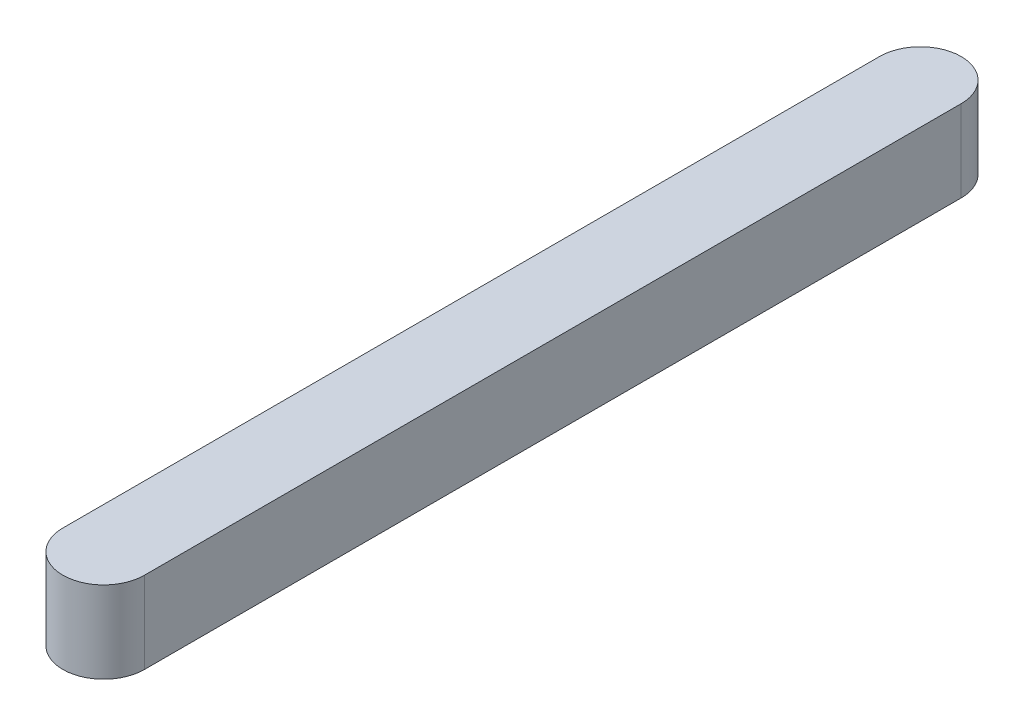
from build123d import *

# Parameters (mm, degrees)
SKETCH1_W           = 34.925
SKETCH1_H           = 3.175
BOSS_EXTRUDE1_DEPTH = 3.175
FILLET1_RADIUS      = 1.5875
FILLET1_LENGTH      = 3.175
FILLET2_RADIUS      = 1.5875
FILLET2_LENGTH      = 3.175


with BuildPart() as part:
    # Sketch1 → Boss-Extrude1 (new body)
    with BuildSketch(Plane(origin=(0, 0, 0), x_dir=(0, 0, -1), z_dir=(1, 0, 0))):
        with Locations((17.4625, 1.5875)):
            Rectangle(SKETCH1_W, SKETCH1_H)
    extrude(amount=BOSS_EXTRUDE1_DEPTH)

    # Fillet1: full round fillet: the end face becomes a half cylinder, R = half its width
    fillet1_face = Plane((1.5875, 1.5875, 0), x_dir=(0, 1, 0), z_dir=(0, 0, 1))  # on the end face: x along it, z out of the body
    fillet1_slab = fillet1_face.offset(-FILLET1_RADIUS / 2) * Box(FILLET1_LENGTH, 2 * FILLET1_RADIUS, FILLET1_RADIUS, mode=Mode.PRIVATE)  # the body's end, R deep
    fillet1_round = Plane((1.5875, 1.5875, -1.5875), x_dir=(0, 0, 1), z_dir=(0, 1, 0)) * Cylinder(FILLET1_RADIUS, FILLET1_LENGTH, mode=Mode.PRIVATE)  # its axis R under the face
    add(fillet1_slab - fillet1_round, mode=Mode.SUBTRACT)

    # Fillet2: full round fillet: the end face becomes a half cylinder, R = half its width
    fillet2_face = Plane((1.5875, 1.5875, -34.925), x_dir=(0, -1, 0), z_dir=(0, 0, -1))  # on the end face: x along it, z out of the body
    fillet2_slab = fillet2_face.offset(-FILLET2_RADIUS / 2) * Box(FILLET2_LENGTH, 2 * FILLET2_RADIUS, FILLET2_RADIUS, mode=Mode.PRIVATE)  # the body's end, R deep
    fillet2_round = Plane((1.5875, 1.5875, -33.3375), x_dir=(0, 0, -1), z_dir=(0, -1, 0)) * Cylinder(FILLET2_RADIUS, FILLET2_LENGTH, mode=Mode.PRIVATE)  # its axis R under the face
    add(fillet2_slab - fillet2_round, mode=Mode.SUBTRACT)


solid = part.part
